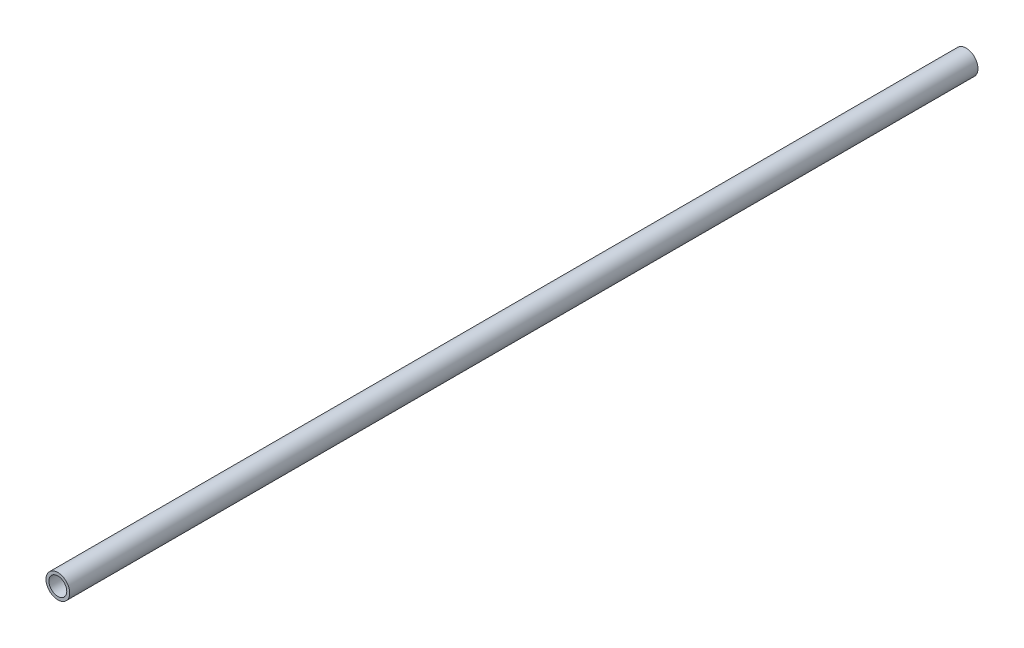
from build123d import *

# Parameters (mm, degrees)
SKETCH_1_R      = 4
SKETCH_1_R_2    = 3
EXTRUDE_1_DEPTH = 306


with BuildPart() as part:
    # 草图1 → 凸台-拉伸1 (new body)
    with BuildSketch(Plane.XY):
        Circle(SKETCH_1_R)
        Circle(SKETCH_1_R_2, mode=Mode.SUBTRACT)
    extrude(amount=EXTRUDE_1_DEPTH)


solid = part.part
